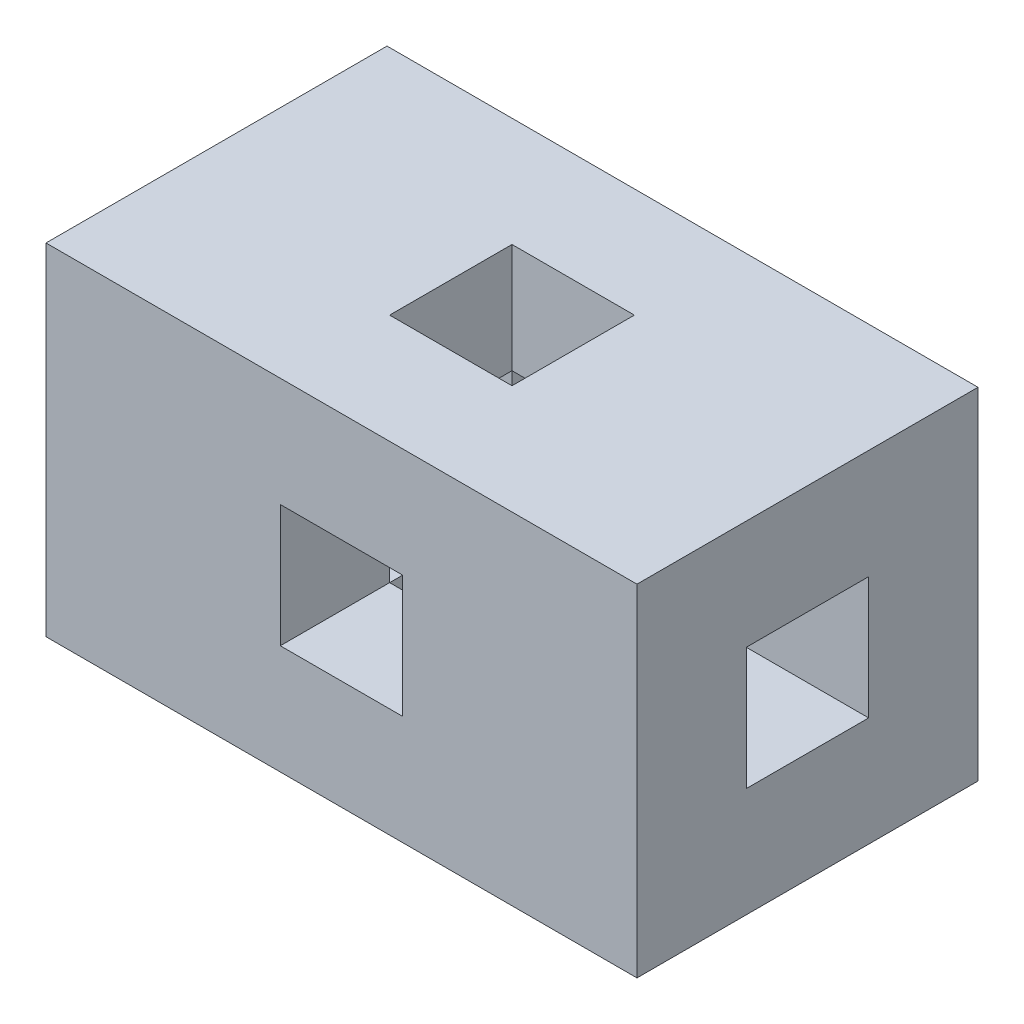
from build123d import *

# Parameters (mm, degrees)
SKETCH1_W           = 74.8284
SKETCH1_H           = 43.18
BOSS_EXTRUDE1_DEPTH = 21.59
SKETCH12_W          = 15.494
SKETCH12_H          = 15.494
CUT_EXTRUDE1_DEPTH  = 62.077515189
SKETCH15_W          = 15.494
SKETCH15_H          = 15.494
CUT_EXTRUDE2_DEPTH  = 62.077515189
SKETCH16_W          = 15.494
SKETCH16_H          = 15.494
CUT_EXTRUDE3_DEPTH  = 81.817978486


with BuildPart() as part:
    # Sketch1 → Boss-Extrude1 (new, symmetric)
    with BuildSketch(Plane(origin=(0, 0, 0), x_dir=(1, 0, 0), z_dir=(0, 1, 0))):
        Rectangle(SKETCH1_W, SKETCH1_H)
    extrude(amount=BOSS_EXTRUDE1_DEPTH, both=True)

    # Sketch12 → Cut-Extrude1 (cut, through all)
    with BuildSketch(Plane(origin=(0, 21.59, 0), x_dir=(1, 0, 0), z_dir=(0, 1, 0))):
        Rectangle(SKETCH12_W, SKETCH12_H)
    extrude(amount=-CUT_EXTRUDE1_DEPTH, mode=Mode.SUBTRACT)

    # Sketch15 → Cut-Extrude2 (cut, through all)
    with BuildSketch(Plane.XY.offset(21.59)):
        Rectangle(SKETCH15_W, SKETCH15_H)
    extrude(amount=-CUT_EXTRUDE2_DEPTH, mode=Mode.SUBTRACT)

    # Sketch16 → Cut-Extrude3 (cut, through all)
    with BuildSketch(Plane(origin=(37.4142, 0, 0), x_dir=(0, 0, -1), z_dir=(1, 0, 0))):
        Rectangle(SKETCH16_W, SKETCH16_H)
    extrude(amount=-CUT_EXTRUDE3_DEPTH, mode=Mode.SUBTRACT)


solid = part.part
